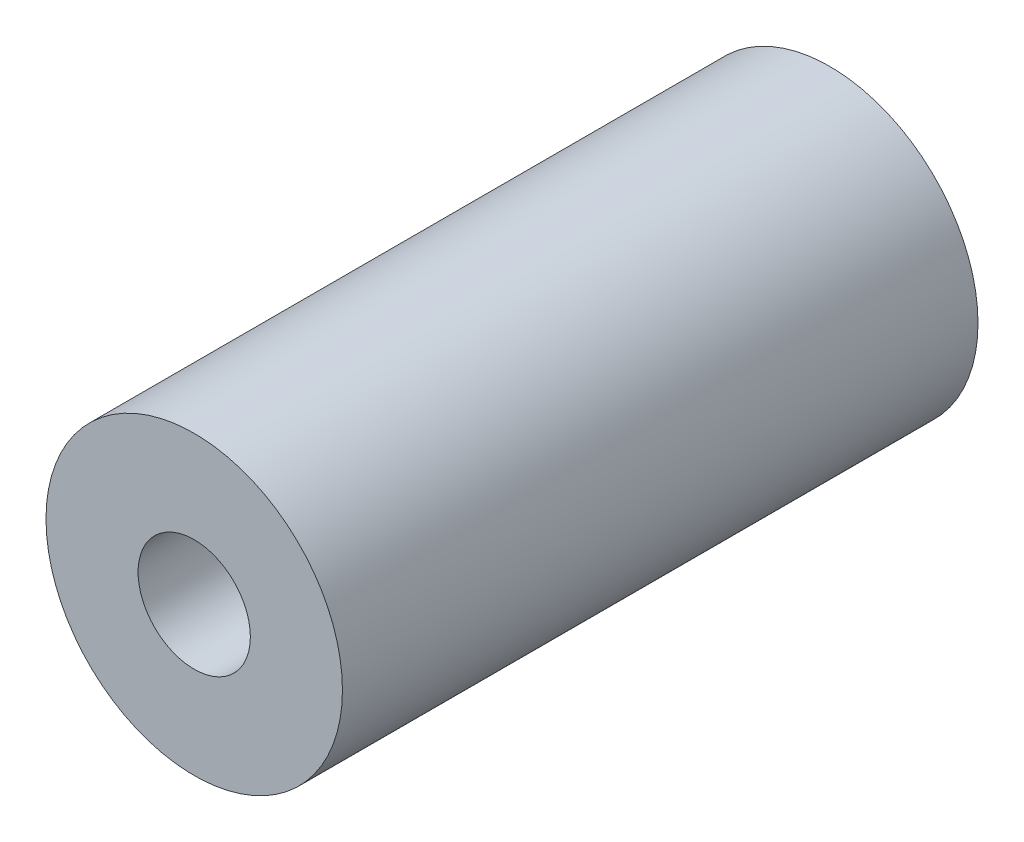
from build123d import *

# Parameters (mm, degrees)
SKETCH2_R           = 6.6
SKETCH2_R_2         = 2.5
BOSS_EXTRUDE1_DEPTH = 28.3


with BuildPart() as part:
    # Sketch2 → Boss-Extrude1 (new body)
    with BuildSketch(Plane.XY):
        Circle(SKETCH2_R)
        Circle(SKETCH2_R_2, mode=Mode.SUBTRACT)
    extrude(amount=-BOSS_EXTRUDE1_DEPTH)


solid = part.part
